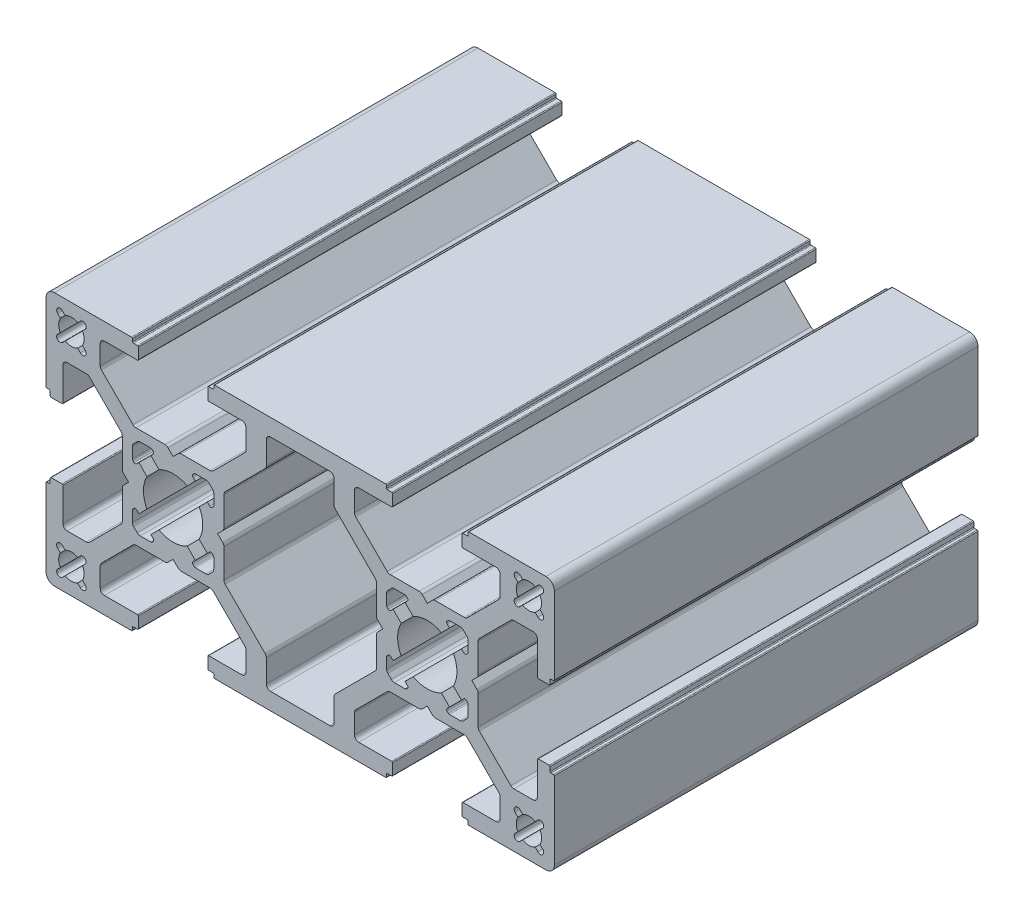
from build123d import *

# Parameters (mm, degrees)
Y_KSEKLIK_EKSTR_ZYON1_DEPTH = 50


with BuildPart() as part:
    # Çizim1 → Yükseklik-Ekstrüzyon1 (new body)
    with BuildSketch(Plane.XY):
        with BuildLine():
            Line((-4.8, 14.6), (-4.8, 14.9))
            ThreePointArc((-4.8, 14.9), (-4.829289322, 14.970710678), (-4.9, 15))
            Line((-4.9, 15), (-14, 15))
            ThreePointArc((-14, 15), (-14.707106781, 14.707106781), (-15, 14))
            Line((-15, 14), (-15, 4.9))
            ThreePointArc((-15, 4.9), (-14.970710678, 4.829289322), (-14.9, 4.8))
            Line((-14.9, 4.8), (-14.6, 4.8))
            ThreePointArc((-14.6, 4.8), (-14.529289322, 4.770710678), (-14.5, 4.7))
            Line((-14.5, 4.7), (-14.5, 4.2))
            ThreePointArc((-14.5, 4.2), (-14.470710678, 4.129289322), (-14.4, 4.1))
            Line((-14.4, 4.1), (-13.1, 4.1))
            ThreePointArc((-13.1, 4.1), (-13.029289322, 4.129289322), (-13, 4.2))
            Line((-13, 4.2), (-13, 8.1))
            ThreePointArc((-13, 8.1), (-12.853553391, 8.453553391), (-12.5, 8.6))
            Line((-12.5, 8.6), (-10.221320344, 8.6))
            ThreePointArc((-10.221320344, 8.6), (-10.029978627, 8.561939766), (-9.867766953, 8.453553391))
            Line((-9.867766953, 8.453553391), (-6.146446609, 4.732233047))
            ThreePointArc((-6.146446609, 4.732233047), (-6.038060234, 4.570021373), (-6, 4.378679656))
            Line((-6, 4.378679656), (-6, 0.957106781))
            ThreePointArc((-6, 0.957106781), (-5.961939766, 0.765765065), (-5.853553391, 0.603553391))
            Line((-5.853553391, 0.603553391), (-5.25, 0))
            Line((-5.25, 0), (-5.853553391, -0.603553391))
            ThreePointArc((-5.853553391, -0.603553391), (-5.961939766, -0.765765065), (-6, -0.957106781))
            Line((-6, -0.957106781), (-6, -4.378679656))
            ThreePointArc((-6, -4.378679656), (-6.038060234, -4.570021373), (-6.146446609, -4.732233047))
            Line((-6.146446609, -4.732233047), (-9.867766953, -8.453553391))
            ThreePointArc((-9.867766953, -8.453553391), (-10.029978627, -8.561939766), (-10.221320344, -8.6))
            Line((-10.221320344, -8.6), (-12.5, -8.6))
            ThreePointArc((-12.5, -8.6), (-12.853553391, -8.453553391), (-13, -8.1))
            Line((-13, -8.1), (-13, -4.2))
            ThreePointArc((-13, -4.2), (-13.029289322, -4.129289322), (-13.1, -4.1))
            Line((-13.1, -4.1), (-14.4, -4.1))
            ThreePointArc((-14.4, -4.1), (-14.470710678, -4.129289322), (-14.5, -4.2))
            Line((-14.5, -4.2), (-14.5, -4.7))
            ThreePointArc((-14.5, -4.7), (-14.529289322, -4.770710678), (-14.6, -4.8))
            Line((-14.6, -4.8), (-14.9, -4.8))
            ThreePointArc((-14.9, -4.8), (-14.970710678, -4.829289322), (-15, -4.9))
            Line((-15, -4.9), (-15, -14))
            ThreePointArc((-15, -14), (-14.707106781, -14.707106781), (-14, -15))
            Line((-14, -15), (-4.9, -15))
            ThreePointArc((-4.9, -15), (-4.829289322, -14.970710678), (-4.8, -14.9))
            Line((-4.8, -14.9), (-4.8, -14.6))
            ThreePointArc((-4.8, -14.6), (-4.770710678, -14.529289322), (-4.7, -14.5))
            Line((-4.7, -14.5), (-4.2, -14.5))
            ThreePointArc((-4.2, -14.5), (-4.129289322, -14.470710678), (-4.1, -14.4))
            Line((-4.1, -14.4), (-4.1, -13.1))
            ThreePointArc((-4.1, -13.1), (-4.129289322, -13.029289322), (-4.2, -13))
            Line((-4.2, -13), (-8.1, -13))
            ThreePointArc((-8.1, -13), (-8.453553391, -12.853553391), (-8.6, -12.5))
            Line((-8.6, -12.5), (-8.6, -10.221320344))
            ThreePointArc((-8.6, -10.221320344), (-8.561939766, -10.029978627), (-8.453553391, -9.867766953))
            Line((-8.453553391, -9.867766953), (-4.732233047, -6.146446609))
            ThreePointArc((-4.732233047, -6.146446609), (-4.570021373, -6.038060234), (-4.378679656, -6))
            Line((-4.378679656, -6), (-0.957106781, -6))
            ThreePointArc((-0.957106781, -6), (-0.765765065, -5.961939766), (-0.603553391, -5.853553391))
            Line((-0.603553391, -5.853553391), (0, -5.25))
            Line((0, -5.25), (0.603553391, -5.853553391))
            ThreePointArc((0.603553391, -5.853553391), (0.765765065, -5.961939766), (0.957106781, -6))
            Line((0.957106781, -6), (4.378679656, -6))
            ThreePointArc((4.378679656, -6), (4.570021373, -6.038060234), (4.732233047, -6.146446609))
            Line((4.732233047, -6.146446609), (8.453553391, -9.867766953))
            ThreePointArc((8.453553391, -9.867766953), (8.561939766, -10.029978627), (8.6, -10.221320344))
            Line((8.6, -10.221320344), (8.6, -12.5))
            ThreePointArc((8.6, -12.5), (8.453553391, -12.853553391), (8.1, -13))
            Line((8.1, -13), (4.2, -13))
            ThreePointArc((4.2, -13), (4.129289322, -13.029289322), (4.1, -13.1))
            Line((4.1, -13.1), (4.1, -14.4))
            ThreePointArc((4.1, -14.4), (4.129289322, -14.470710678), (4.2, -14.5))
            Line((4.2, -14.5), (4.7, -14.5))
            ThreePointArc((4.7, -14.5), (4.770710678, -14.529289322), (4.8, -14.6))
            Line((4.8, -14.6), (4.8, -14.9))
            ThreePointArc((4.8, -14.9), (4.829289322, -14.970710678), (4.9, -15))
            Line((4.9, -15), (15, -15))
            Line((15, -15), (15, -13))
            Line((15, -13), (11.5, -13))
            ThreePointArc((11.5, -13), (11.146446609, -12.853553391), (11, -12.5))
            Line((11, -12.5), (11, -9.792893219))
            ThreePointArc((11, -9.792893219), (10.961939766, -9.601551503), (10.853553391, -9.439339828))
            Line((10.853553391, -9.439339828), (6.146446609, -4.732233047))
            ThreePointArc((6.146446609, -4.732233047), (6.038060234, -4.570021373), (6, -4.378679656))
            Line((6, -4.378679656), (6, -0.957106781))
            ThreePointArc((6, -0.957106781), (5.961939766, -0.765765065), (5.853553391, -0.603553391))
            Line((5.853553391, -0.603553391), (5.25, 0))
            Line((5.25, 0), (5.853553391, 0.603553391))
            ThreePointArc((5.853553391, 0.603553391), (5.961939766, 0.765765065), (6, 0.957106781))
            Line((6, 0.957106781), (6, 4.378679656))
            ThreePointArc((6, 4.378679656), (6.038060234, 4.570021373), (6.146446609, 4.732233047))
            Line((6.146446609, 4.732233047), (10.853553391, 9.439339828))
            ThreePointArc((10.853553391, 9.439339828), (10.961939766, 9.601551503), (11, 9.792893219))
            Line((11, 9.792893219), (11, 12.5))
            ThreePointArc((11, 12.5), (11.146446609, 12.853553391), (11.5, 13))
            Line((11.5, 13), (15, 13))
            Line((15, 13), (15, 15))
            Line((15, 15), (4.9, 15))
            ThreePointArc((4.9, 15), (4.829289322, 14.970710678), (4.8, 14.9))
            Line((4.8, 14.9), (4.8, 14.6))
            ThreePointArc((4.8, 14.6), (4.770710678, 14.529289322), (4.7, 14.5))
            Line((4.7, 14.5), (4.2, 14.5))
            ThreePointArc((4.2, 14.5), (4.129289322, 14.470710678), (4.1, 14.4))
            Line((4.1, 14.4), (4.1, 13.1))
            ThreePointArc((4.1, 13.1), (4.129289322, 13.029289322), (4.2, 13))
            Line((4.2, 13), (8.1, 13))
            ThreePointArc((8.1, 13), (8.453553391, 12.853553391), (8.6, 12.5))
            Line((8.6, 12.5), (8.6, 10.221320344))
            ThreePointArc((8.6, 10.221320344), (8.561939766, 10.029978627), (8.453553391, 9.867766953))
            Line((8.453553391, 9.867766953), (4.732233047, 6.146446609))
            ThreePointArc((4.732233047, 6.146446609), (4.570021373, 6.038060234), (4.378679656, 6))
            Line((4.378679656, 6), (0.957106781, 6))
            ThreePointArc((0.957106781, 6), (0.765765065, 5.961939766), (0.603553391, 5.853553391))
            Line((0.603553391, 5.853553391), (0, 5.25))
            Line((0, 5.25), (-0.603553391, 5.853553391))
            ThreePointArc((-0.603553391, 5.853553391), (-0.765765065, 5.961939766), (-0.957106781, 6))
            Line((-0.957106781, 6), (-4.378679656, 6))
            ThreePointArc((-4.378679656, 6), (-4.570021373, 6.038060234), (-4.732233047, 6.146446609))
            Line((-4.732233047, 6.146446609), (-8.453553391, 9.867766953))
            ThreePointArc((-8.453553391, 9.867766953), (-8.561939766, 10.029978627), (-8.6, 10.221320344))
            Line((-8.6, 10.221320344), (-8.6, 12.5))
            ThreePointArc((-8.6, 12.5), (-8.453553391, 12.853553391), (-8.1, 13))
            Line((-8.1, 13), (-4.2, 13))
            ThreePointArc((-4.2, 13), (-4.129289322, 13.029289322), (-4.1, 13.1))
            Line((-4.1, 13.1), (-4.1, 14.4))
            ThreePointArc((-4.1, 14.4), (-4.129289322, 14.470710678), (-4.2, 14.5))
            Line((-4.2, 14.5), (-4.7, 14.5))
            ThreePointArc((-4.7, 14.5), (-4.770710678, 14.529289322), (-4.8, 14.6))
        make_face()
        with BuildLine():
            Line((-1.664601464, -3.078815026), (-2.624264069, -4.038477631))
            Line((-2.624264069, -4.038477631), (-2.341421356, -4.321320344))
            ThreePointArc((-2.341421356, -4.321320344), (-2.282842712, -4.4627417), (-2.341421356, -4.604163056))
            Line((-2.341421356, -4.604163056), (-2.478679656, -4.741421356))
            ThreePointArc((-2.478679656, -4.741421356), (-2.543564326, -4.784775907), (-2.620101013, -4.8))
            Line((-2.620101013, -4.8), (-3.885786438, -4.8))
            ThreePointArc((-3.885786438, -4.8), (-4.077128154, -4.761939766), (-4.239339828, -4.653553391))
            Line((-4.239339828, -4.653553391), (-4.653553391, -4.239339828))
            ThreePointArc((-4.653553391, -4.239339828), (-4.761939766, -4.077128154), (-4.8, -3.885786438))
            Line((-4.8, -3.885786438), (-4.8, -2.620101013))
            ThreePointArc((-4.8, -2.620101013), (-4.784775907, -2.543564326), (-4.741421356, -2.478679656))
            Line((-4.741421356, -2.478679656), (-4.604163056, -2.341421356))
            ThreePointArc((-4.604163056, -2.341421356), (-4.4627417, -2.282842712), (-4.321320344, -2.341421356))
            Line((-4.321320344, -2.341421356), (-4.038477631, -2.624264069))
            Line((-4.038477631, -2.624264069), (-3.078815026, -1.664601464))
            ThreePointArc((-3.078815026, -1.664601464), (-3.5, 0), (-3.078815026, 1.664601464))
            Line((-3.078815026, 1.664601464), (-4.038477631, 2.624264069))
            Line((-4.038477631, 2.624264069), (-4.321320344, 2.341421356))
            ThreePointArc((-4.321320344, 2.341421356), (-4.4627417, 2.282842712), (-4.604163056, 2.341421356))
            Line((-4.604163056, 2.341421356), (-4.741421356, 2.478679656))
            ThreePointArc((-4.741421356, 2.478679656), (-4.784775907, 2.543564326), (-4.8, 2.620101013))
            Line((-4.8, 2.620101013), (-4.8, 3.885786438))
            ThreePointArc((-4.8, 3.885786438), (-4.761939766, 4.077128154), (-4.653553391, 4.239339828))
            Line((-4.653553391, 4.239339828), (-4.239339828, 4.653553391))
            ThreePointArc((-4.239339828, 4.653553391), (-4.077128154, 4.761939766), (-3.885786438, 4.8))
            Line((-3.885786438, 4.8), (-2.620101013, 4.8))
            ThreePointArc((-2.620101013, 4.8), (-2.543564326, 4.784775907), (-2.478679656, 4.741421356))
            Line((-2.478679656, 4.741421356), (-2.341421356, 4.604163056))
            ThreePointArc((-2.341421356, 4.604163056), (-2.282842712, 4.4627417), (-2.341421356, 4.321320344))
            Line((-2.341421356, 4.321320344), (-2.624264069, 4.038477631))
            Line((-2.624264069, 4.038477631), (-1.664601464, 3.078815026))
            ThreePointArc((-1.664601464, 3.078815026), (0, 3.5), (1.664601464, 3.078815026))
            Line((1.664601464, 3.078815026), (2.624264069, 4.038477631))
            Line((2.624264069, 4.038477631), (2.341421356, 4.321320344))
            ThreePointArc((2.341421356, 4.321320344), (2.282842712, 4.4627417), (2.341421356, 4.604163056))
            Line((2.341421356, 4.604163056), (2.478679656, 4.741421356))
            ThreePointArc((2.478679656, 4.741421356), (2.543564326, 4.784775907), (2.620101013, 4.8))
            Line((2.620101013, 4.8), (3.885786438, 4.8))
            ThreePointArc((3.885786438, 4.8), (4.077128154, 4.761939766), (4.239339828, 4.653553391))
            Line((4.239339828, 4.653553391), (4.653553391, 4.239339828))
            ThreePointArc((4.653553391, 4.239339828), (4.761939766, 4.077128154), (4.8, 3.885786438))
            Line((4.8, 3.885786438), (4.8, 2.620101013))
            ThreePointArc((4.8, 2.620101013), (4.784775907, 2.543564326), (4.741421356, 2.478679656))
            Line((4.741421356, 2.478679656), (4.604163056, 2.341421356))
            ThreePointArc((4.604163056, 2.341421356), (4.4627417, 2.282842712), (4.321320344, 2.341421356))
            Line((4.321320344, 2.341421356), (4.038477631, 2.624264069))
            Line((4.038477631, 2.624264069), (3.078815026, 1.664601464))
            ThreePointArc((3.078815026, 1.664601464), (3.5, 0), (3.078815026, -1.664601464))
            Line((3.078815026, -1.664601464), (4.038477631, -2.624264069))
            Line((4.038477631, -2.624264069), (4.321320344, -2.341421356))
            ThreePointArc((4.321320344, -2.341421356), (4.4627417, -2.282842712), (4.604163056, -2.341421356))
            Line((4.604163056, -2.341421356), (4.741421356, -2.478679656))
            ThreePointArc((4.741421356, -2.478679656), (4.784775907, -2.543564326), (4.8, -2.620101013))
            Line((4.8, -2.620101013), (4.8, -3.885786438))
            ThreePointArc((4.8, -3.885786438), (4.761939766, -4.077128154), (4.653553391, -4.239339828))
            Line((4.653553391, -4.239339828), (4.239339828, -4.653553391))
            ThreePointArc((4.239339828, -4.653553391), (4.077128154, -4.761939766), (3.885786438, -4.8))
            Line((3.885786438, -4.8), (2.620101013, -4.8))
            ThreePointArc((2.620101013, -4.8), (2.543564326, -4.784775907), (2.478679656, -4.741421356))
            Line((2.478679656, -4.741421356), (2.341421356, -4.604163056))
            ThreePointArc((2.341421356, -4.604163056), (2.282842712, -4.4627417), (2.341421356, -4.321320344))
            Line((2.341421356, -4.321320344), (2.624264069, -4.038477631))
            Line((2.624264069, -4.038477631), (1.664601464, -3.078815026))
            ThreePointArc((1.664601464, -3.078815026), (0, -3.5), (-1.664601464, -3.078815026))
        make_face(mode=Mode.SUBTRACT)
        with BuildLine():
            ThreePointArc((-12.739409703, 13.305095127), (-12, 13.5), (-11.260590297, 13.305095127))
            Line((-11.260590297, 13.305095127), (-10.939339828, 13.626345597))
            ThreePointArc((-10.939339828, 13.626345597), (-10.373654403, 13.626345597), (-10.373654403, 13.060660172))
            Line((-10.373654403, 13.060660172), (-10.694904873, 12.739409703))
            ThreePointArc((-10.694904873, 12.739409703), (-10.5, 12), (-10.694904873, 11.260590297))
            Line((-10.694904873, 11.260590297), (-10.373654403, 10.939339828))
            ThreePointArc((-10.373654403, 10.939339828), (-10.373654403, 10.373654403), (-10.939339828, 10.373654403))
            Line((-10.939339828, 10.373654403), (-11.260590297, 10.694904873))
            ThreePointArc((-11.260590297, 10.694904873), (-12, 10.5), (-12.739409703, 10.694904873))
            Line((-12.739409703, 10.694904873), (-13.060660172, 10.373654403))
            ThreePointArc((-13.060660172, 10.373654403), (-13.626345597, 10.373654403), (-13.626345597, 10.939339828))
            Line((-13.626345597, 10.939339828), (-13.305095127, 11.260590297))
            ThreePointArc((-13.305095127, 11.260590297), (-13.5, 12), (-13.305095127, 12.739409703))
            Line((-13.305095127, 12.739409703), (-13.626345597, 13.060660172))
            ThreePointArc((-13.626345597, 13.060660172), (-13.626345597, 13.626345597), (-13.060660172, 13.626345597))
            Line((-13.060660172, 13.626345597), (-12.739409703, 13.305095127))
        make_face(mode=Mode.SUBTRACT)
        with BuildLine():
            Line((-13.305095127, -11.260590297), (-13.626345597, -10.939339828))
            ThreePointArc((-13.626345597, -10.939339828), (-13.626345597, -10.373654403), (-13.060660172, -10.373654403))
            Line((-13.060660172, -10.373654403), (-12.739409703, -10.694904873))
            ThreePointArc((-12.739409703, -10.694904873), (-12, -10.5), (-11.260590297, -10.694904873))
            Line((-11.260590297, -10.694904873), (-10.939339828, -10.373654403))
            ThreePointArc((-10.939339828, -10.373654403), (-10.373654403, -10.373654403), (-10.373654403, -10.939339828))
            Line((-10.373654403, -10.939339828), (-10.694904873, -11.260590297))
            ThreePointArc((-10.694904873, -11.260590297), (-10.5, -12), (-10.694904873, -12.739409703))
            Line((-10.694904873, -12.739409703), (-10.373654403, -13.060660172))
            ThreePointArc((-10.373654403, -13.060660172), (-10.373654403, -13.626345597), (-10.939339828, -13.626345597))
            Line((-10.939339828, -13.626345597), (-11.260590297, -13.305095127))
            ThreePointArc((-11.260590297, -13.305095127), (-12, -13.5), (-12.739409703, -13.305095127))
            Line((-12.739409703, -13.305095127), (-13.060660172, -13.626345597))
            ThreePointArc((-13.060660172, -13.626345597), (-13.626345597, -13.626345597), (-13.626345597, -13.060660172))
            Line((-13.626345597, -13.060660172), (-13.305095127, -12.739409703))
            ThreePointArc((-13.305095127, -12.739409703), (-13.5, -12), (-13.305095127, -11.260590297))
        make_face(mode=Mode.SUBTRACT)
    extrude(amount=-Y_KSEKLIK_EKSTR_ZYON1_DEPTH)

    # Aynalama1: part across plane


with BuildPart() as part_1:
    add(part.part)
    add(part.part.mirror(Plane(origin=(15, 0, -50), x_dir=(0, 0, 1), z_dir=(1, 0, 0))))


solid = part_1.part
